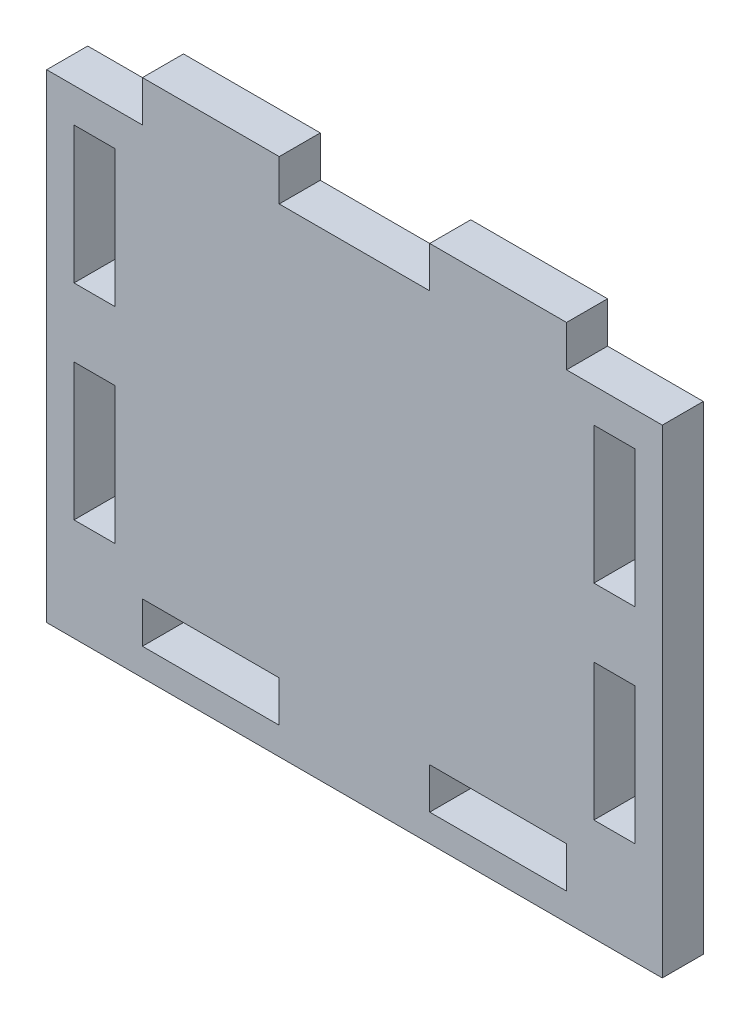
from build123d import *

# Parameters (mm, degrees)
SKETCH_1_W      = 10
SKETCH_1_H      = 3
SKETCH_1_W_2    = 3
SKETCH_1_H_2    = 10
EXTRUDE_1_DEPTH = 3


with BuildPart() as part:
    # 草图1 → 凸台-拉伸1 (new body)
    with BuildSketch(Plane.XY):
        Polygon((-22.5, 15), (-15.5, 15), (-15.5, 18), (-5.5, 18), (-5.5, 15), (5.5, 15), (5.5, 18), (15.5, 18), (15.5, 15), (22.5, 15), (22.5, -15), (22.5, -20), (-22.5, -20), (-22.5, -15), align=None)
        with Locations((-10.5, -16.5)):
            Rectangle(SKETCH_1_W, SKETCH_1_H, mode=Mode.SUBTRACT)
        with Locations((-19, -7.5)):
            Rectangle(SKETCH_1_W_2, SKETCH_1_H_2, mode=Mode.SUBTRACT)
        with Locations((10.5, -16.5)):
            Rectangle(SKETCH_1_W, SKETCH_1_H, mode=Mode.SUBTRACT)
        with Locations((-19, 7.5)):
            Rectangle(SKETCH_1_W_2, SKETCH_1_H_2, mode=Mode.SUBTRACT)
        with Locations((19, -7.5)):
            Rectangle(SKETCH_1_W_2, SKETCH_1_H_2, mode=Mode.SUBTRACT)
        with Locations((19, 7.5)):
            Rectangle(SKETCH_1_W_2, SKETCH_1_H_2, mode=Mode.SUBTRACT)
    extrude(amount=EXTRUDE_1_DEPTH)


solid = part.part
